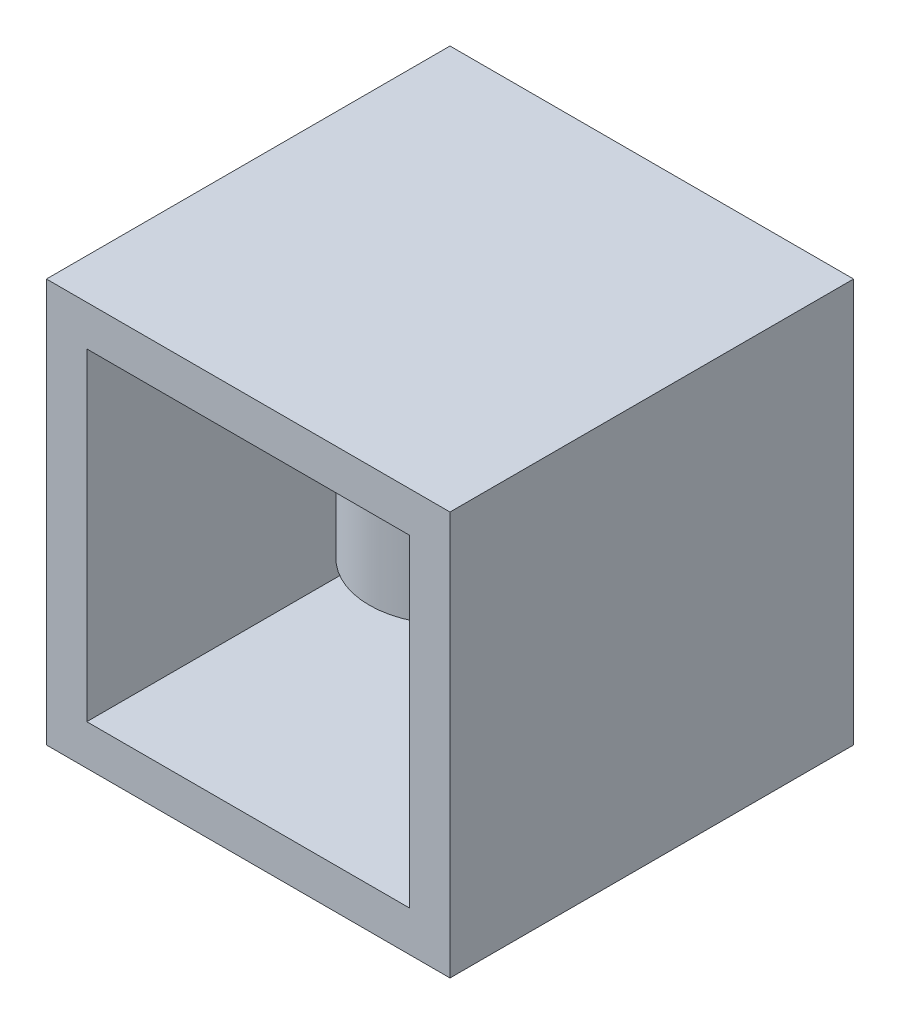
from build123d import *

# Parameters (mm, degrees)
SKETCH1_W           = 1000
SKETCH1_H           = 1000
SKETCH1_W_2         = 800
SKETCH1_H_2         = 800
BOSS_EXTRUDE1_DEPTH = 1000
SKETCH2_R           = 200
BOSS_EXTRUDE2_DEPTH = 500


with BuildPart() as part:
    # Sketch1 → Boss-Extrude1 (new body)
    with BuildSketch(Plane.XY):
        with Locations((500, 500)):
            Rectangle(SKETCH1_W, SKETCH1_H)
        with Locations((500, 500)):
            Rectangle(SKETCH1_W_2, SKETCH1_H_2, mode=Mode.SUBTRACT)
    extrude(amount=BOSS_EXTRUDE1_DEPTH)

    # Sketch2 → Boss-Extrude2 (add)
    with BuildSketch(Plane.XZ.offset(-900)):
        with Locations(Location((500, 500, 0), (0, 0, 90))):
            Circle(SKETCH2_R)
    extrude(amount=BOSS_EXTRUDE2_DEPTH)


solid = part.part
